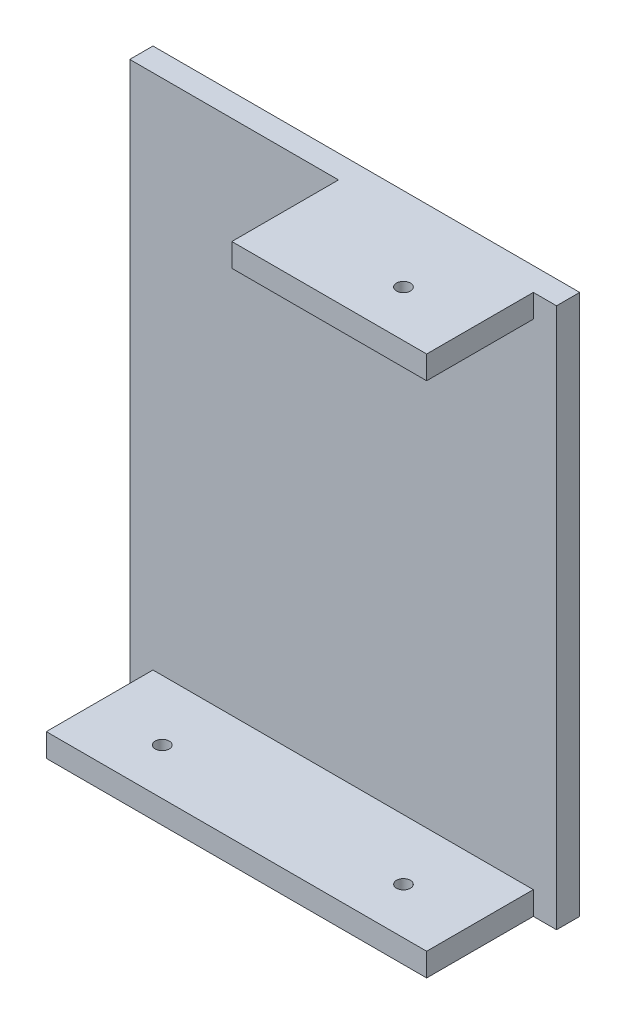
from build123d import *

# Parameters (mm, degrees)
SKETCH_1_W          = 92
SKETCH_1_H          = 116.5
EXTRUDE_1_DEPTH     = 5
SKETCH_2_W          = 82
SKETCH_2_H          = 5
SKETCH_2_W_2        = 42
EXTRUDE_2_DEPTH     = 23
SKETCH_3_R          = 1.5
CUT_EXTRUDE_1_DEPTH = 129.653427027


with BuildPart() as part:
    # 草圖1 → 填料-伸長1 (new body)
    with BuildSketch(Plane.XY):
        with Locations((0.855675066, -22.881766382)):
            Rectangle(SKETCH_1_W, SKETCH_1_H)
    extrude(amount=EXTRUDE_1_DEPTH)

    # 草圖2 → 填料-伸長2 (add)
    with BuildSketch(Plane.XY.offset(5)):
        with Locations((0.855675066, -78.631766382)):
            Rectangle(SKETCH_2_W, SKETCH_2_H)
        with Locations((20.855675066, 32.868233618)):
            Rectangle(SKETCH_2_W_2, SKETCH_2_H)
    extrude(amount=EXTRUDE_2_DEPTH)

    # 草圖3 → 除料-伸長1 (cut, through all)
    with BuildSketch(Plane.XZ.offset(81.131766382)):
        with Locations(Location((-25.144324934, 18, 0), (0, 0, 270))):
            Circle(SKETCH_3_R)
        with Locations(Location((26.855675066, 18, 0), (0, 0, 270))):
            Circle(SKETCH_3_R)
    extrude(amount=-CUT_EXTRUDE_1_DEPTH, mode=Mode.SUBTRACT)


solid = part.part
